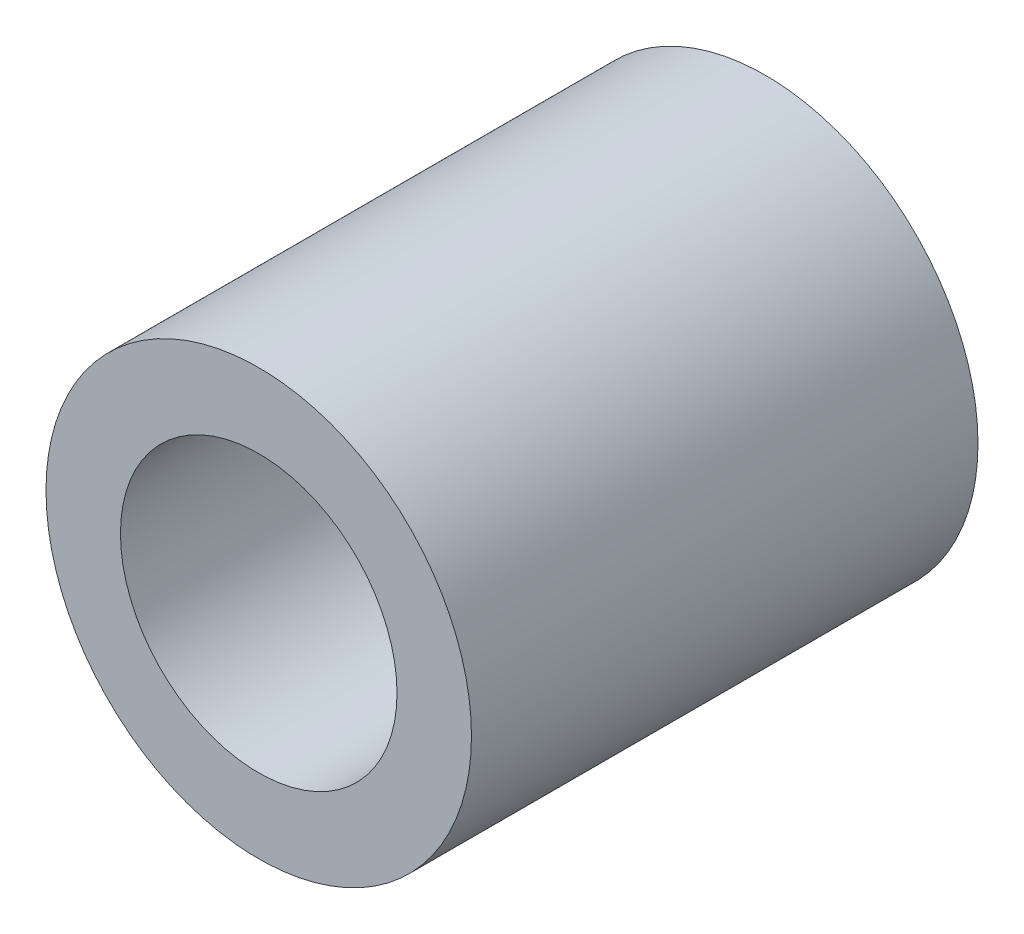
from build123d import *

# Parameters (mm, degrees)
SKETCH1_R           = 10.668
SKETCH1_R_2         = 6.9342
BOSS_EXTRUDE1_DEPTH = 25.4


with BuildPart() as part:
    # Sketch1 → Boss-Extrude1 (new body)
    with BuildSketch(Plane.XY):
        Circle(SKETCH1_R)
        Circle(SKETCH1_R_2, mode=Mode.SUBTRACT)
    extrude(amount=BOSS_EXTRUDE1_DEPTH)


solid = part.part
